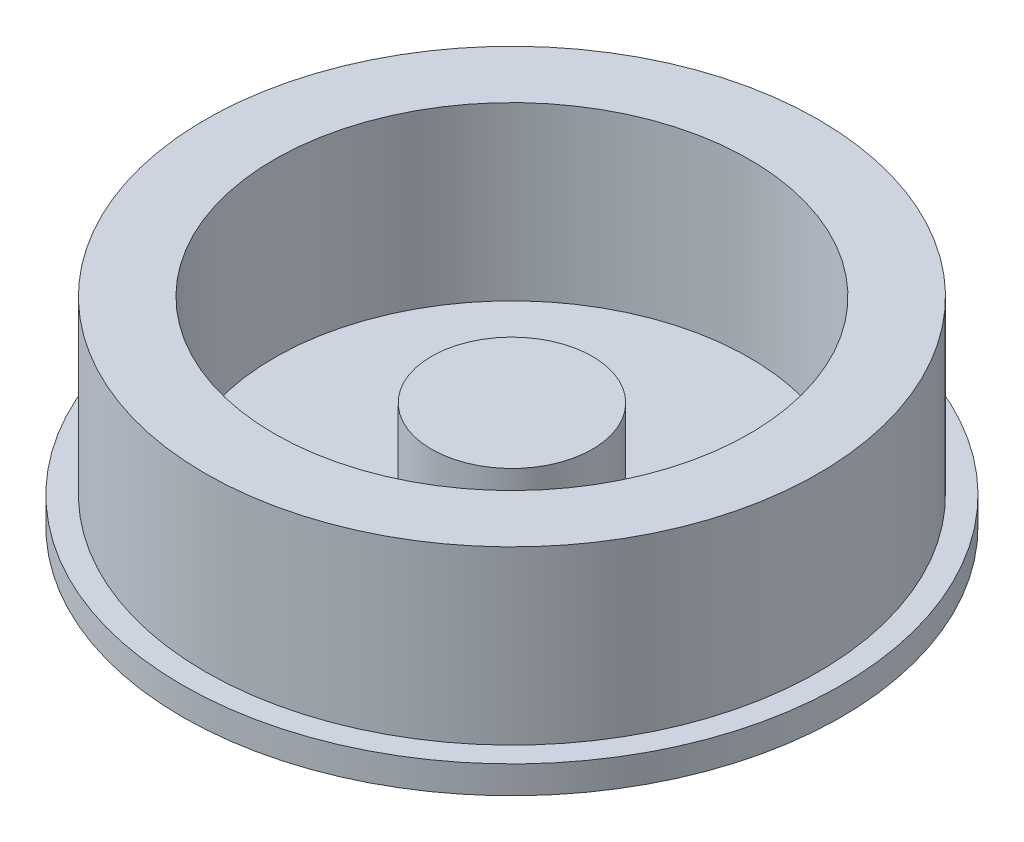
from build123d import *

# Parameters (mm, degrees)
F_01_BOWL_FLANGE_PROFILE_R   = 215
F_01_BOWL_FLANGE_PROFILE_R_2 = 6
F_01_BOWL_BASE_FLANGE_DEPTH  = 18
F_02_BOWL_WALL_PROFILE_R     = 200
F_02_BOWL_WALL_PROFILE_R_2   = 155
F_02_BOWL_WALL_DEPTH         = 130
F_03_CENTER_CONE_BASE_R      = 52.5
F_03_CENTER_GUIDE_BOSS_DEPTH = 70


with BuildPart() as part:
    # 01_Bowl_Flange_Profile → 01_Bowl_Base_Flange (new body)
    with BuildSketch(Plane(origin=(0, 0, 0), x_dir=(1, 0, 0), z_dir=(0, 1, 0))):
        with Locations(Location((0, 0, 0), (0, 0, 270))):
            Circle(F_01_BOWL_FLANGE_PROFILE_R)
        with Locations(Location((170.917713515, 70.796434988, 0), (0, 0, 270))):
            Circle(F_01_BOWL_FLANGE_PROFILE_R_2, mode=Mode.SUBTRACT)
        with Locations(Location((70.796434988, 170.917713515, 0), (0, 0, 270))):
            Circle(F_01_BOWL_FLANGE_PROFILE_R_2, mode=Mode.SUBTRACT)
        with Locations(Location((-70.796434988, 170.917713515, 0), (0, 0, 270))):
            Circle(F_01_BOWL_FLANGE_PROFILE_R_2, mode=Mode.SUBTRACT)
        with Locations(Location((-170.917713515, 70.796434988, 0), (0, 0, 270))):
            Circle(F_01_BOWL_FLANGE_PROFILE_R_2, mode=Mode.SUBTRACT)
        with Locations(Location((-170.917713515, -70.796434988, 0), (0, 0, 270))):
            Circle(F_01_BOWL_FLANGE_PROFILE_R_2, mode=Mode.SUBTRACT)
        with Locations(Location((-70.796434988, -170.917713515, 0), (0, 0, 270))):
            Circle(F_01_BOWL_FLANGE_PROFILE_R_2, mode=Mode.SUBTRACT)
        with Locations(Location((70.796434988, -170.917713515, 0), (0, 0, 270))):
            Circle(F_01_BOWL_FLANGE_PROFILE_R_2, mode=Mode.SUBTRACT)
        with Locations(Location((170.917713515, -70.796434988, 0), (0, 0, 270))):
            Circle(F_01_BOWL_FLANGE_PROFILE_R_2, mode=Mode.SUBTRACT)
    extrude(amount=F_01_BOWL_BASE_FLANGE_DEPTH)

    # 02_Bowl_Wall_Profile → 02_Bowl_Wall (add)
    with BuildSketch(Plane(origin=(0, 0, 0), x_dir=(1, 0, 0), z_dir=(0, 1, 0))):
        with Locations(Location((0, 0, 0), (0, 0, 270))):
            Circle(F_02_BOWL_WALL_PROFILE_R)
        with Locations(Location((0, 0, 0), (0, 0, 270))):
            Circle(F_02_BOWL_WALL_PROFILE_R_2, mode=Mode.SUBTRACT)
    extrude(amount=F_02_BOWL_WALL_DEPTH)

    # 03_Center_Cone_Base → 03_Center_Guide_Boss (add)
    with BuildSketch(Plane(origin=(0, 0, 0), x_dir=(1, 0, 0), z_dir=(0, 1, 0))):
        with Locations(Location((0, 0, 0), (0, 0, 270))):
            Circle(F_03_CENTER_CONE_BASE_R)
    extrude(amount=F_03_CENTER_GUIDE_BOSS_DEPTH)


solid = part.part
